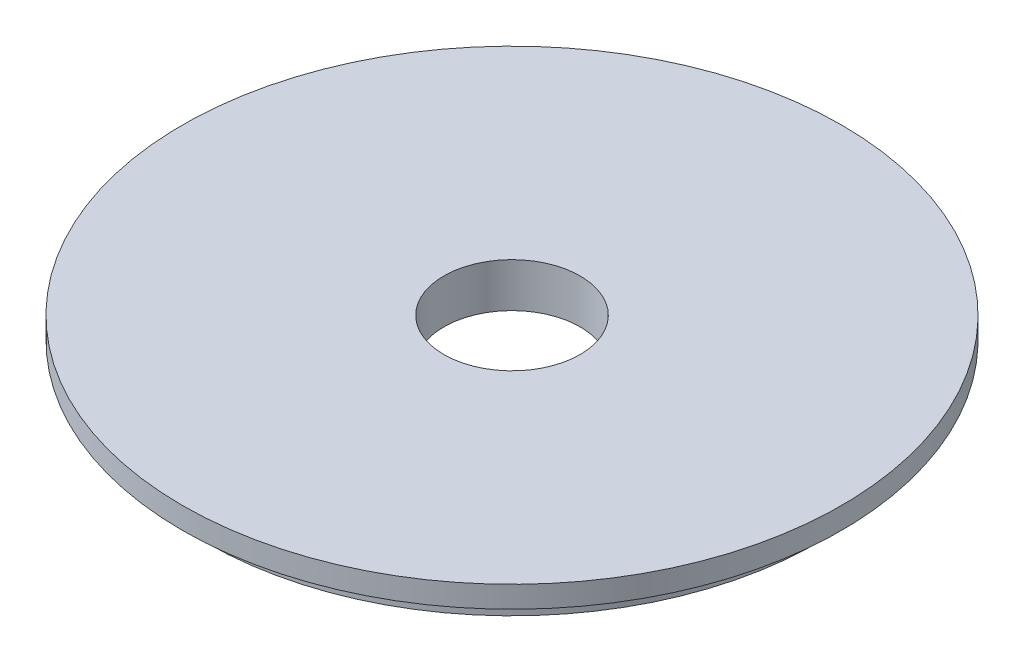
from build123d import *


with BuildPart() as part:
    # Sketch1 → Revolve1 (revolve)
    with BuildSketch(Plane.XY, mode=Mode.PRIVATE) as revolve1_sk:
        Polygon((-9.525, 0), (-46.0756, 0), (-46.0756, -3.0226), (-42.7482, -3.0226), (-42.7482, -6.1722), (-9.525, -6.1722), align=None)
    revolve(revolve1_sk.sketch.rotate(Axis((0, 0, 0), (0, -1, 0)), 270), axis=Axis((0, 0, 0), (0, -1, 0)))


solid = part.part
